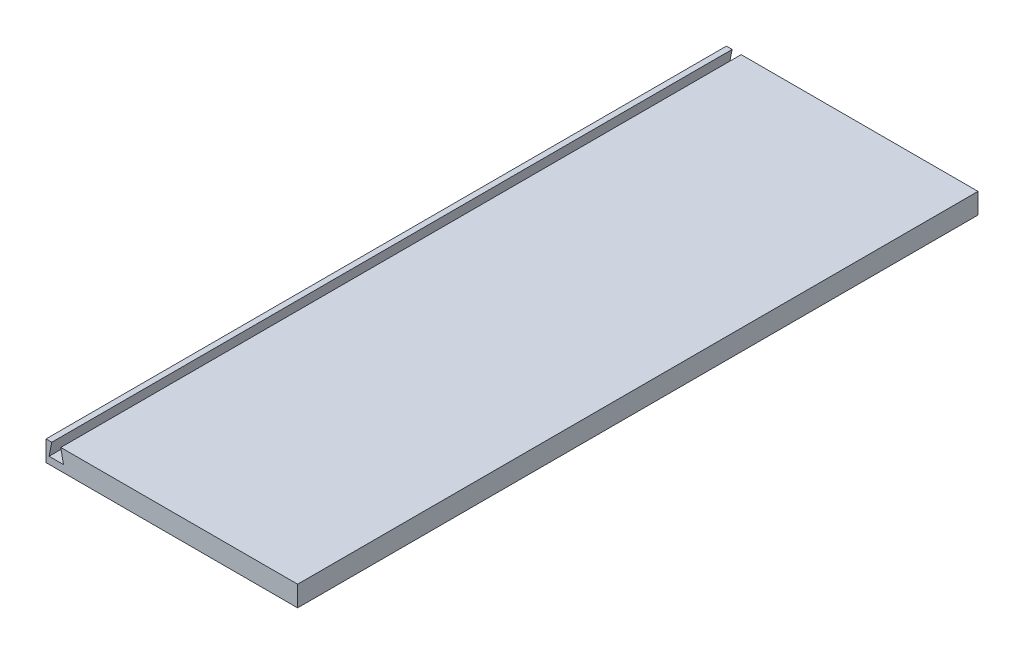
from build123d import *

# Parameters (mm, degrees)
SKETCH1_W           = 98
SKETCH1_H           = 8
BOSS_EXTRUDE1_DEPTH = 265
CUT_EXTRUDE2_DEPTH  = 265


with BuildPart() as part:
    # Sketch1 → Boss-Extrude1 (new body)
    with BuildSketch(Plane.XY):
        with Locations((49, 4)):
            Rectangle(SKETCH1_W, SKETCH1_H)
    extrude(amount=-BOSS_EXTRUDE1_DEPTH)

    # Sketch2 → Cut-Extrude2 (cut)
    with BuildSketch(Plane.XY):
        Polygon((2.245049024, 8), (1.195049024, 2.75), (6.804950976, 2.75), (5.754950976, 8), align=None)
    extrude(amount=-CUT_EXTRUDE2_DEPTH, mode=Mode.SUBTRACT)


solid = part.part
